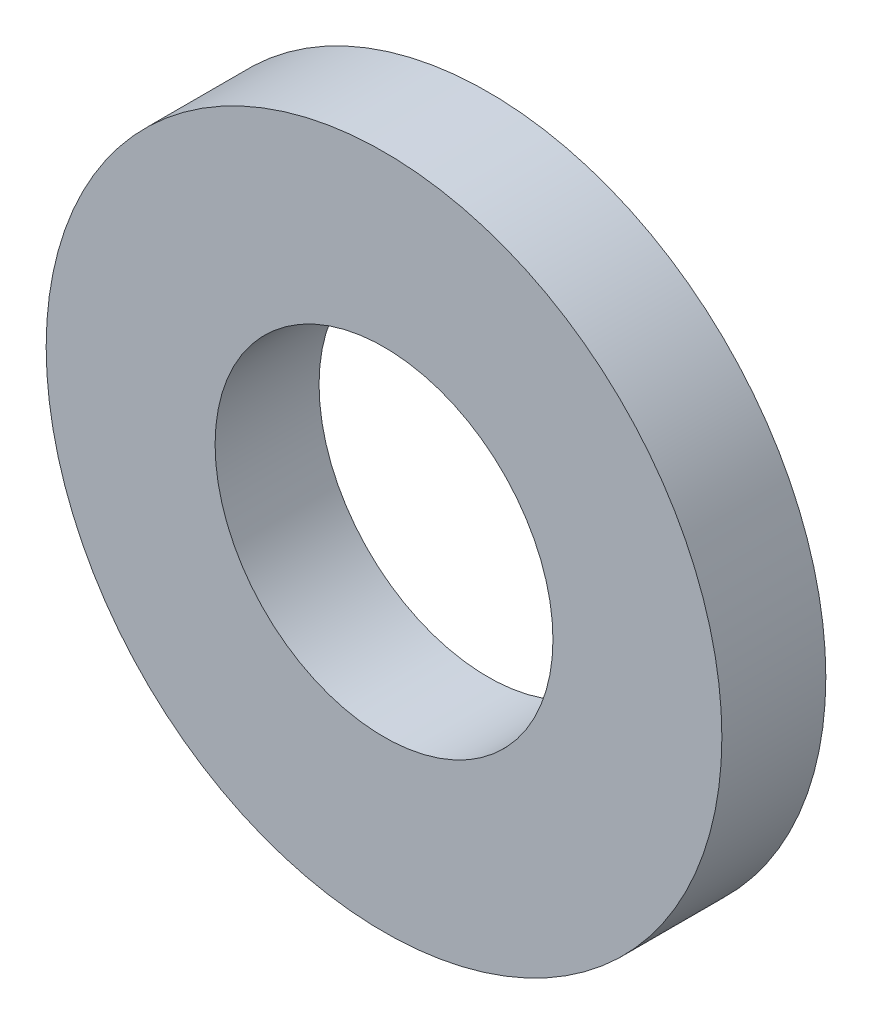
from build123d import *

# Parameters (mm, degrees)
SKETCH_1_R      = 32.5
SKETCH_1_R_2    = 16.25
EXTRUDE_1_DEPTH = 10


with BuildPart() as part:
    # Эскиз1 → Бобышка-Вытянуть1 (new body)
    with BuildSketch(Plane.XY):
        Circle(SKETCH_1_R)
        Circle(SKETCH_1_R_2, mode=Mode.SUBTRACT)
    extrude(amount=EXTRUDE_1_DEPTH)


solid = part.part
